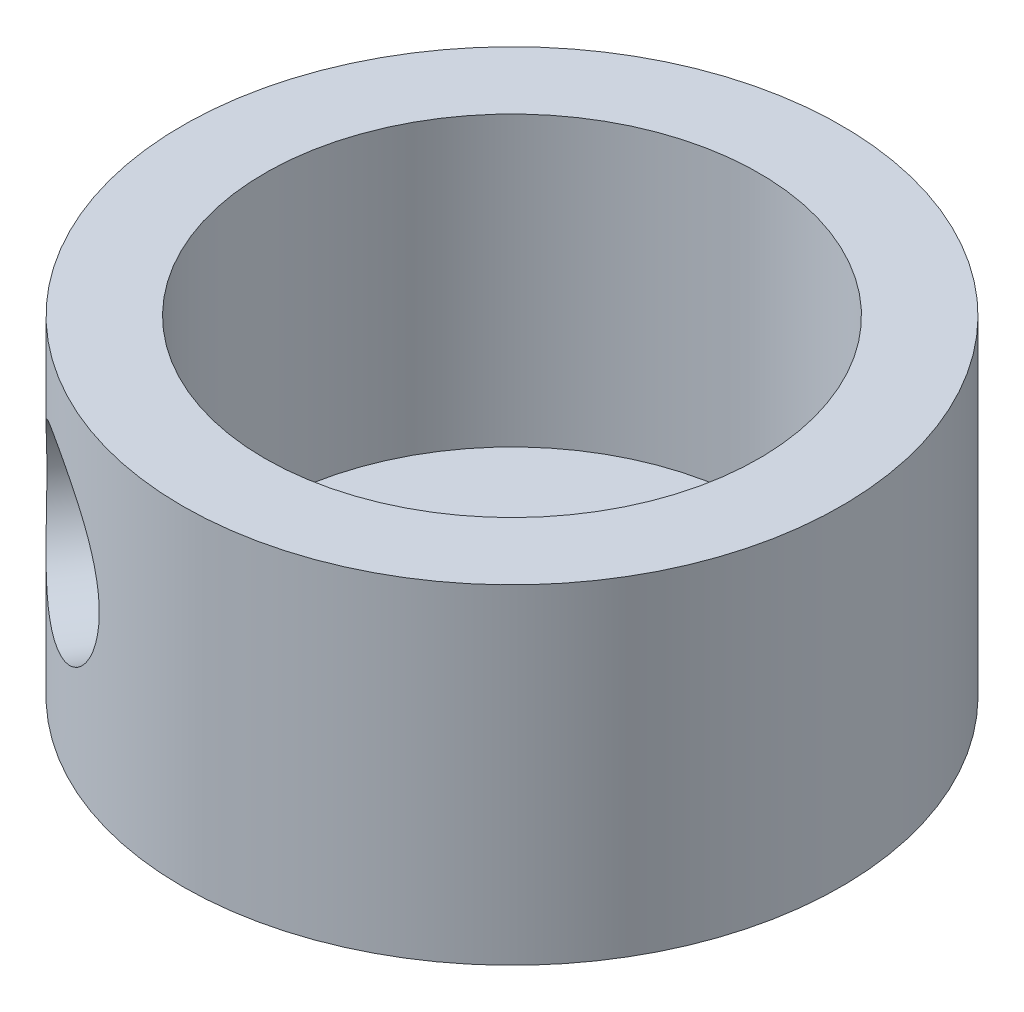
from build123d import *

# Parameters (mm, degrees)
SKETCH_1_R                     = 40
EXTRUDE_1_DEPTH                = 40
SKETCH_3_R                     = 30
CUT_EXTRUDE_2_DEPTH            = 35
HOLE_WIZARD_21_5_21_5_1_REACH  = 100.524
HOLE_WIZARD_21_5_21_5_1_BORE_R = 10.75


with BuildPart() as part:
    # 草圖1 → 填料-伸長1 (new body)
    with BuildSketch(Plane(origin=(0, 0, 0), x_dir=(1, 0, 0), z_dir=(0, 1, 0))):
        with Locations(Location((0, 0, 0), (0, 0, 270))):
            Circle(SKETCH_1_R)
    extrude(amount=EXTRUDE_1_DEPTH)

    # 草圖3 → 除料-伸長2 (cut)
    with BuildSketch(Plane(origin=(0, 40, 0), x_dir=(1, 0, 0), z_dir=(0, 1, 0))):
        with Locations(Location((0, 0, 0), (0, 0, 270))):
            Circle(SKETCH_3_R)
    extrude(amount=-CUT_EXTRUDE_2_DEPTH, mode=Mode.SUBTRACT)

    # Ø21.5 (21.5) 直徑孔1 bore (on position points) → Ø21.5 (21.5) 直徑孔1 (cut, up to next)
    with BuildSketch(Plane(origin=(-21.744758151, 21.94181737, 33.573285406), x_dir=(0.839332135156, 0, 0.543618953768), z_dir=(-0.543618953768, 0, 0.839332135156)), mode=Mode.PRIVATE) as hole_wizard_21_5_21_5_1_sk1:
        Circle(HOLE_WIZARD_21_5_21_5_1_BORE_R)
    hole_wizard_21_5_21_5_1_tool1 = extrude(hole_wizard_21_5_21_5_1_sk1.sketch, amount=-HOLE_WIZARD_21_5_21_5_1_REACH, mode=Mode.PRIVATE) & part.part
    add(hole_wizard_21_5_21_5_1_tool1.solids().sort_by_distance((-21.744758, 21.941817, 33.573285))[0], mode=Mode.SUBTRACT)


solid = part.part
